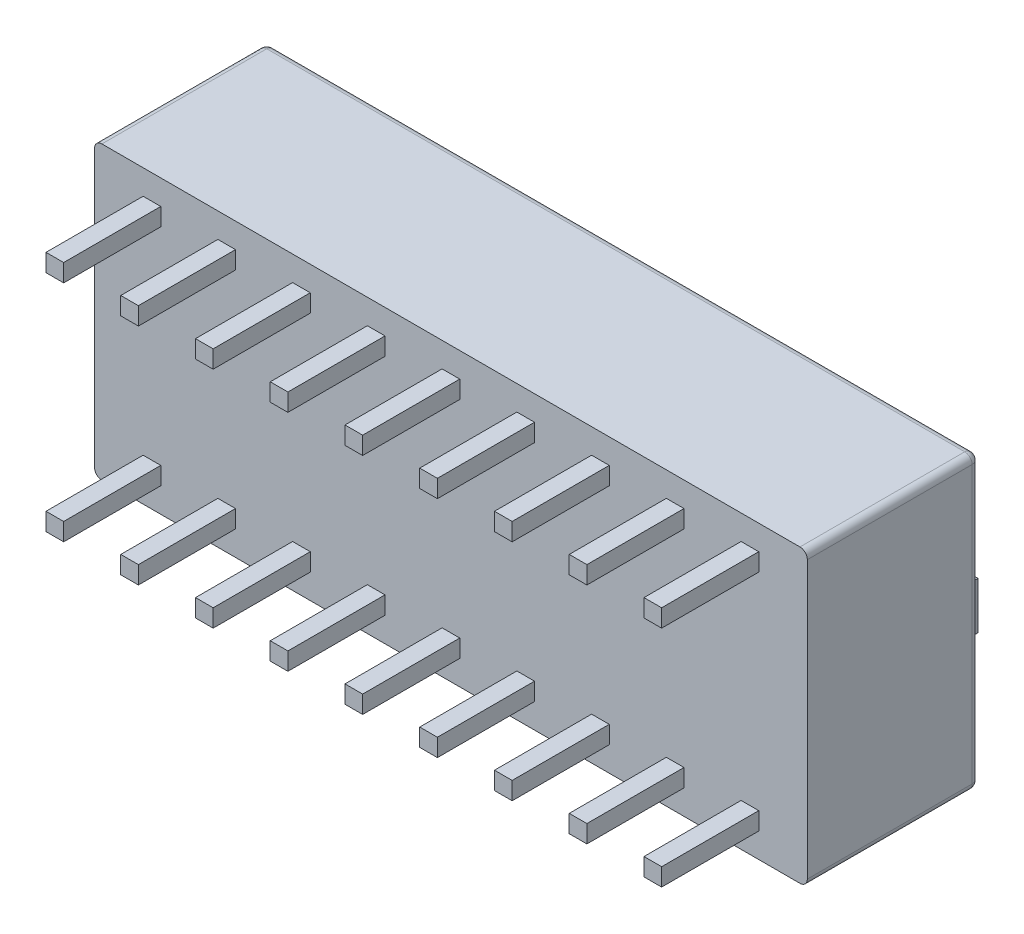
from build123d import *

# Parameters (mm, degrees)
IZIM1_W                       = 24.22
IZIM1_H                       = 9.9
Y_KSEKLIK_EKSTR_ZYON1_DEPTH   = 5.85
IZIM3_W                       = 1.4
IZIM3_H                       = 3.2
KES_EKSTR_ZYON1_DEPTH         = 1
IZIM5_W                       = 1.4
IZIM5_H                       = 1.6
Y_KSEKLIK_EKSTR_ZYON2_DEPTH   = 2.2
Y_KSEKLIK_EKSTR_ZYON2_2_DEPTH = 2.2
Y_KSEKLIK_EKSTR_ZYON2_3_DEPTH = 2.2
Y_KSEKLIK_EKSTR_ZYON2_4_DEPTH = 2.2
Y_KSEKLIK_EKSTR_ZYON2_5_DEPTH = 2.2
Y_KSEKLIK_EKSTR_ZYON2_6_DEPTH = 2.2
Y_KSEKLIK_EKSTR_ZYON2_7_DEPTH = 2.2
Y_KSEKLIK_EKSTR_ZYON2_8_DEPTH = 2.2
Y_KSEKLIK_EKSTR_ZYON2_9_DEPTH = 2.2
IZIM6_W                       = 1.4
IZIM6_H                       = 1.6
Y_KSEKLIK_EKSTR_ZYON3_DEPTH   = 0.9
Y_KSEKLIK_EKSTR_ZYON3_2_DEPTH = 0.9
Y_KSEKLIK_EKSTR_ZYON3_3_DEPTH = 0.9
Y_KSEKLIK_EKSTR_ZYON3_4_DEPTH = 0.9
Y_KSEKLIK_EKSTR_ZYON3_5_DEPTH = 0.9
Y_KSEKLIK_EKSTR_ZYON3_6_DEPTH = 0.9
Y_KSEKLIK_EKSTR_ZYON3_7_DEPTH = 0.9
Y_KSEKLIK_EKSTR_ZYON3_8_DEPTH = 0.9
Y_KSEKLIK_EKSTR_ZYON3_9_DEPTH = 0.9
RADYUS1_R                     = 0.25
IZIM7_W                       = 0.6
IZIM7_H                       = 0.6
Y_KSEKLIK_EKSTR_ZYON4_DEPTH   = 3.3


with BuildPart() as part:
    # Çizim1 → Yükseklik-Ekstrüzyon1 (new body)
    with BuildSketch(Plane.XY):
        Rectangle(IZIM1_W, IZIM1_H)
    extrude(amount=Y_KSEKLIK_EKSTR_ZYON1_DEPTH)

    # Çizim3 → Kes-Ekstrüzyon1 (cut)
    with BuildSketch(Plane(origin=(0, 0, 0), x_dir=(-1, 0, 0), z_dir=(0, 0, -1))):
        with Locations((-10.16, 0)):
            Rectangle(IZIM3_W, IZIM3_H)
        with Locations((-7.62, 0)):
            Rectangle(IZIM3_W, IZIM3_H)
        with Locations((-5.08, 0)):
            Rectangle(IZIM3_W, IZIM3_H)
        with Locations((-2.54, 0)):
            Rectangle(IZIM3_W, IZIM3_H)
        Rectangle(IZIM3_W, IZIM3_H)
        with Locations((2.54, 0)):
            Rectangle(IZIM3_W, IZIM3_H)
        with Locations((5.08, 0)):
            Rectangle(IZIM3_W, IZIM3_H)
        with Locations((7.62, 0)):
            Rectangle(IZIM3_W, IZIM3_H)
        with Locations((10.16, 0)):
            Rectangle(IZIM3_W, IZIM3_H)
    extrude(amount=-KES_EKSTR_ZYON1_DEPTH, mode=Mode.SUBTRACT)

    # Radyus1
    radyus1_edges = [part.edges().sort_by_distance(p)[0] for p in [
        (0, -4.95, 0),
        (-12.11, 0, 0),
        (0, 4.95, 0),
        (12.11, 0, 0),
        (12.11, -4.95, 2.925),
        (-12.11, -4.95, 2.925),
        (-12.11, 4.95, 2.925),
        (12.11, 4.95, 2.925),
    ]]
    fillet(radyus1_edges, radius=RADYUS1_R)

    # Çizim7 → Yükseklik-Ekstrüzyon4 (add)
    with BuildSketch(Plane.XY.offset(5.85)):
        with Locations((-10.16, 3.81)):
            Rectangle(IZIM7_W, IZIM7_H)
        with Locations((-7.62, 3.81)):
            Rectangle(IZIM7_W, IZIM7_H)
        with Locations((-5.08, 3.81)):
            Rectangle(IZIM7_W, IZIM7_H)
        with Locations((-2.54, 3.81)):
            Rectangle(IZIM7_W, IZIM7_H)
        with Locations((0, 3.81)):
            Rectangle(IZIM7_W, IZIM7_H)
        with Locations((2.54, 3.81)):
            Rectangle(IZIM7_W, IZIM7_H)
        with Locations((5.08, 3.81)):
            Rectangle(IZIM7_W, IZIM7_H)
        with Locations((7.62, 3.81)):
            Rectangle(IZIM7_W, IZIM7_H)
        with Locations((10.16, 3.81)):
            Rectangle(IZIM7_W, IZIM7_H)
        with Locations((10.16, -3.81)):
            Rectangle(IZIM7_W, IZIM7_H)
        with Locations((7.62, -3.81)):
            Rectangle(IZIM7_W, IZIM7_H)
        with Locations((5.08, -3.81)):
            Rectangle(IZIM7_W, IZIM7_H)
        with Locations((2.54, -3.81)):
            Rectangle(IZIM7_W, IZIM7_H)
        with Locations((0, -3.81)):
            Rectangle(IZIM7_W, IZIM7_H)
        with Locations((-2.54, -3.81)):
            Rectangle(IZIM7_W, IZIM7_H)
        with Locations((-5.08, -3.81)):
            Rectangle(IZIM7_W, IZIM7_H)
        with Locations((-7.62, -3.81)):
            Rectangle(IZIM7_W, IZIM7_H)
        with Locations((-10.16, -3.81)):
            Rectangle(IZIM7_W, IZIM7_H)
    extrude(amount=Y_KSEKLIK_EKSTR_ZYON4_DEPTH)


with BuildPart() as body_2:
    # Çizim5 → Yükseklik-Ekstrüzyon2 (new body)
    with BuildSketch(Plane(origin=(0, 0, 1), x_dir=(-1, 0, 0), z_dir=(0, 0, -1))):
        with Locations((-10.16, -0.8)):
            Rectangle(IZIM5_W, IZIM5_H)
    extrude(amount=Y_KSEKLIK_EKSTR_ZYON2_DEPTH)


with BuildPart() as body_3:
    # Çizim5 → Y_kseklik-Ekstr_zyon2 2 (new body)
    with BuildSketch(Plane(origin=(0, 0, 1), x_dir=(-1, 0, 0), z_dir=(0, 0, -1))):
        with Locations((-7.62, -0.8)):
            Rectangle(IZIM5_W, IZIM5_H)
    extrude(amount=Y_KSEKLIK_EKSTR_ZYON2_2_DEPTH)


with BuildPart() as body_4:
    # Çizim5 → Y_kseklik-Ekstr_zyon2 3 (new body)
    with BuildSketch(Plane(origin=(0, 0, 1), x_dir=(-1, 0, 0), z_dir=(0, 0, -1))):
        with Locations((-5.08, -0.8)):
            Rectangle(IZIM5_W, IZIM5_H)
    extrude(amount=Y_KSEKLIK_EKSTR_ZYON2_3_DEPTH)


with BuildPart() as body_5:
    # Çizim5 → Y_kseklik-Ekstr_zyon2 4 (new body)
    with BuildSketch(Plane(origin=(0, 0, 1), x_dir=(-1, 0, 0), z_dir=(0, 0, -1))):
        with Locations((-2.54, -0.8)):
            Rectangle(IZIM5_W, IZIM5_H)
    extrude(amount=Y_KSEKLIK_EKSTR_ZYON2_4_DEPTH)


with BuildPart() as body_6:
    # Çizim5 → Y_kseklik-Ekstr_zyon2 5 (new body)
    with BuildSketch(Plane(origin=(0, 0, 1), x_dir=(-1, 0, 0), z_dir=(0, 0, -1))):
        with Locations((0, -0.8)):
            Rectangle(IZIM5_W, IZIM5_H)
    extrude(amount=Y_KSEKLIK_EKSTR_ZYON2_5_DEPTH)


with BuildPart() as body_7:
    # Çizim5 → Y_kseklik-Ekstr_zyon2 6 (new body)
    with BuildSketch(Plane(origin=(0, 0, 1), x_dir=(-1, 0, 0), z_dir=(0, 0, -1))):
        with Locations((2.54, -0.8)):
            Rectangle(IZIM5_W, IZIM5_H)
    extrude(amount=Y_KSEKLIK_EKSTR_ZYON2_6_DEPTH)


with BuildPart() as body_8:
    # Çizim5 → Y_kseklik-Ekstr_zyon2 7 (new body)
    with BuildSketch(Plane(origin=(0, 0, 1), x_dir=(-1, 0, 0), z_dir=(0, 0, -1))):
        with Locations((5.08, -0.8)):
            Rectangle(IZIM5_W, IZIM5_H)
    extrude(amount=Y_KSEKLIK_EKSTR_ZYON2_7_DEPTH)


with BuildPart() as body_9:
    # Çizim5 → Y_kseklik-Ekstr_zyon2 8 (new body)
    with BuildSketch(Plane(origin=(0, 0, 1), x_dir=(-1, 0, 0), z_dir=(0, 0, -1))):
        with Locations((7.62, -0.8)):
            Rectangle(IZIM5_W, IZIM5_H)
    extrude(amount=Y_KSEKLIK_EKSTR_ZYON2_8_DEPTH)


with BuildPart() as body_10:
    # Çizim5 → Y_kseklik-Ekstr_zyon2 9 (new body)
    with BuildSketch(Plane(origin=(0, 0, 1), x_dir=(-1, 0, 0), z_dir=(0, 0, -1))):
        with Locations((10.16, -0.8)):
            Rectangle(IZIM5_W, IZIM5_H)
    extrude(amount=Y_KSEKLIK_EKSTR_ZYON2_9_DEPTH)


with BuildPart() as body_11:
    # Çizim6 → Yükseklik-Ekstrüzyon3 (new body)
    with BuildSketch(Plane(origin=(0, 0, 1), x_dir=(-1, 0, 0), z_dir=(0, 0, -1))):
        with Locations((-10.16, 0.8)):
            Rectangle(IZIM6_W, IZIM6_H)
    extrude(amount=Y_KSEKLIK_EKSTR_ZYON3_DEPTH)


with BuildPart() as body_12:
    # Çizim6 → Y_kseklik-Ekstr_zyon3 2 (new body)
    with BuildSketch(Plane(origin=(0, 0, 1), x_dir=(-1, 0, 0), z_dir=(0, 0, -1))):
        with Locations((-7.62, 0.8)):
            Rectangle(IZIM6_W, IZIM6_H)
    extrude(amount=Y_KSEKLIK_EKSTR_ZYON3_2_DEPTH)


with BuildPart() as body_13:
    # Çizim6 → Y_kseklik-Ekstr_zyon3 3 (new body)
    with BuildSketch(Plane(origin=(0, 0, 1), x_dir=(-1, 0, 0), z_dir=(0, 0, -1))):
        with Locations((-5.08, 0.8)):
            Rectangle(IZIM6_W, IZIM6_H)
    extrude(amount=Y_KSEKLIK_EKSTR_ZYON3_3_DEPTH)


with BuildPart() as body_14:
    # Çizim6 → Y_kseklik-Ekstr_zyon3 4 (new body)
    with BuildSketch(Plane(origin=(0, 0, 1), x_dir=(-1, 0, 0), z_dir=(0, 0, -1))):
        with Locations((-2.54, 0.8)):
            Rectangle(IZIM6_W, IZIM6_H)
    extrude(amount=Y_KSEKLIK_EKSTR_ZYON3_4_DEPTH)


with BuildPart() as body_15:
    # Çizim6 → Y_kseklik-Ekstr_zyon3 5 (new body)
    with BuildSketch(Plane(origin=(0, 0, 1), x_dir=(-1, 0, 0), z_dir=(0, 0, -1))):
        with Locations((0, 0.8)):
            Rectangle(IZIM6_W, IZIM6_H)
    extrude(amount=Y_KSEKLIK_EKSTR_ZYON3_5_DEPTH)


with BuildPart() as body_16:
    # Çizim6 → Y_kseklik-Ekstr_zyon3 6 (new body)
    with BuildSketch(Plane(origin=(0, 0, 1), x_dir=(-1, 0, 0), z_dir=(0, 0, -1))):
        with Locations((2.54, 0.8)):
            Rectangle(IZIM6_W, IZIM6_H)
    extrude(amount=Y_KSEKLIK_EKSTR_ZYON3_6_DEPTH)


with BuildPart() as body_17:
    # Çizim6 → Y_kseklik-Ekstr_zyon3 7 (new body)
    with BuildSketch(Plane(origin=(0, 0, 1), x_dir=(-1, 0, 0), z_dir=(0, 0, -1))):
        with Locations((5.08, 0.8)):
            Rectangle(IZIM6_W, IZIM6_H)
    extrude(amount=Y_KSEKLIK_EKSTR_ZYON3_7_DEPTH)


with BuildPart() as body_18:
    # Çizim6 → Y_kseklik-Ekstr_zyon3 8 (new body)
    with BuildSketch(Plane(origin=(0, 0, 1), x_dir=(-1, 0, 0), z_dir=(0, 0, -1))):
        with Locations((7.62, 0.8)):
            Rectangle(IZIM6_W, IZIM6_H)
    extrude(amount=Y_KSEKLIK_EKSTR_ZYON3_8_DEPTH)


with BuildPart() as body_19:
    # Çizim6 → Y_kseklik-Ekstr_zyon3 9 (new body)
    with BuildSketch(Plane(origin=(0, 0, 1), x_dir=(-1, 0, 0), z_dir=(0, 0, -1))):
        with Locations((10.16, 0.8)):
            Rectangle(IZIM6_W, IZIM6_H)
    extrude(amount=Y_KSEKLIK_EKSTR_ZYON3_9_DEPTH)


solid = Compound([part.part, body_2.part, body_3.part, body_4.part, body_5.part, body_6.part, body_7.part, body_8.part, body_9.part, body_10.part, body_11.part, body_12.part, body_13.part, body_14.part, body_15.part, body_16.part, body_17.part, body_18.part, body_19.part])
